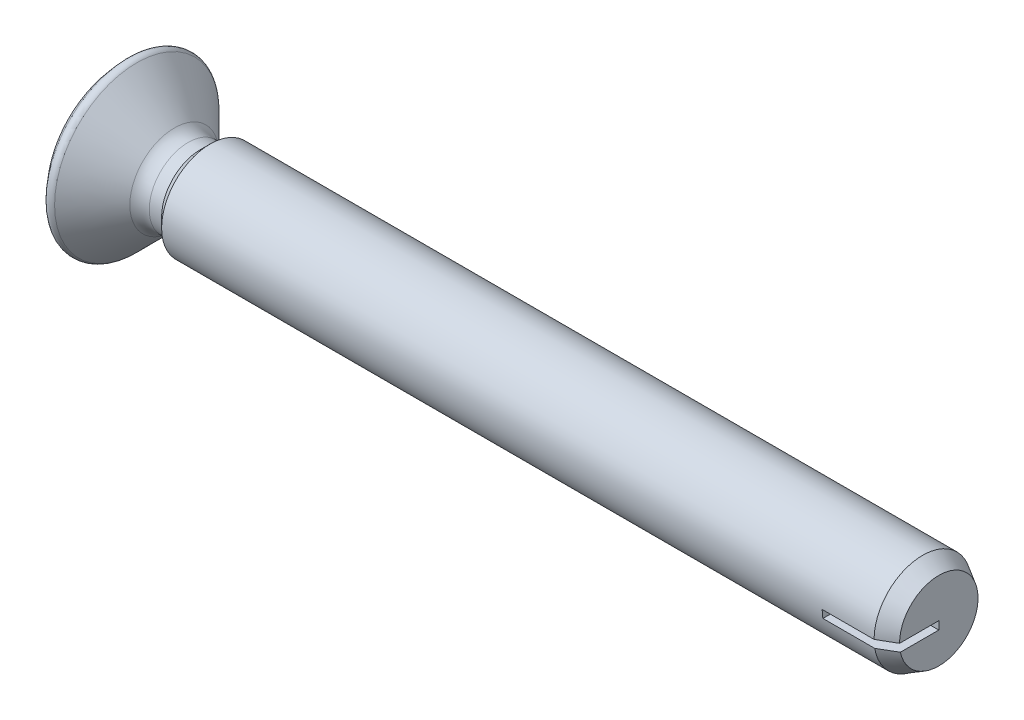
from build123d import *

# Parameters (mm, degrees)
CUT_EXTRUDE3_DEPTH         = 2.5
DRAFT1_ANGLE               = -20
RECESSI_CUT_EXTRUDE5_DEPTH = 2.5
SKETCH11_W                 = 7
SKETCH11_H                 = 0.833333333
POINT_CUT_EXTRUDE8_DEPTH   = 84.894801943


with BuildPart() as part:
    # Sketch1 → base-Revolve (revolve)
    with BuildSketch(Plane.XY, mode=Mode.PRIVATE) as base_revolve_sk:
        with BuildLine():
            Line((0.441941738, 8.458058262), (4.314213562, 4.585786438))
            ThreePointArc((4.314213562, 4.585786438), (4.96306026, 4.152240935), (5.728427125, 4))
            Line((5.728427125, 4), (7, 4))
            Line((7, 4), (8, 5))
            Line((8, 5), (83, 5))
            Line((83, 5), (83, 0))
            Line((83, 0), (0, 0))
            Line((0, 0), (-3.821717386, 0))
            ThreePointArc((-3.821717386, 0), (-2.948605496, 4.546518178), (-0.453487574, 8.446202584))
            ThreePointArc((-0.453487574, 8.446202584), (-0.00827441, 8.641061748), (0.441941738, 8.458058262))
        make_face()
    revolve(base_revolve_sk.sketch.rotate(Axis((0, 0, 0), (1, 0, 0)), 90), axis=Axis((0, 0, 0), (1, 0, 0)))

    # Sketch4 → Cut-Extrude3 (cut)
    with BuildSketch(Plane(origin=(-3.821717386, 0, 0), x_dir=(0, 0, -1), z_dir=(1, 0, 0))):
        Polygon((0.99, 4.94), (-0.99, 4.94), (-0.99, 0.99), (-4.94, 0.99), (-4.94, -0.99), (-0.99, -0.99), (-0.99, -4.94), (0.99, -4.94), (0.99, -0.99), (4.94, -0.99), (4.94, 0.99), (0.99, 0.99), align=None)
    extrude(amount=CUT_EXTRUDE3_DEPTH, mode=Mode.SUBTRACT)

    # Draft1
    draft1_faces = [part.faces().sort_by_distance(p)[0] for p in [
        (-2.045493587, 0, -4.94),
        (-2.045493587, -4.94, 0),
        (-2.045493587, 0, 4.94),
        (-2.045493587, 4.94, 0),
    ]]
    draft(draft1_faces, Plane(origin=(-3.821717386, 0, 0), x_dir=(0, 0, 1), z_dir=(1, 0, 0)), DRAFT1_ANGLE)

    # Sketch5 → recessI_Cut-Extrude5 (cut)
    with BuildSketch(Plane.ZY.offset(3.821717386)):
        Polygon((0.99, 1.978), (1.978, 0.99), (0.99, 0.99), align=None)
        Polygon((-0.99, 0.99), (-1.978, 0.99), (-0.99, 1.978), align=None)
        Polygon((-0.99, -1.978), (-1.978, -0.99), (-0.99, -0.99), align=None)
        Polygon((0.99, -0.99), (1.978, -0.99), (0.99, -1.978), align=None)
    extrude(amount=-RECESSI_CUT_EXTRUDE5_DEPTH, mode=Mode.SUBTRACT)

    # Sketch8 → point_Cut-Revolve1 (revolve, cut)
    with BuildSketch(Plane.XY, mode=Mode.PRIVATE) as point_cut_revolve1_sk:
        Polygon((83, 0), (83.508, 0), (83.508, 5.508), (81.337231225, 5.508), (81.337231225, 5), (83, 4.04), align=None)
    revolve(point_cut_revolve1_sk.sketch.rotate(Axis((0, 0, 0), (1, 0, 0)), 90), axis=Axis((0, 0, 0), (1, 0, 0)), mode=Mode.SUBTRACT)

    # Sketch11 → point_Cut-Extrude8 (cut, through all)
    with BuildSketch(Plane.XY):
        with Locations((79.5, -0.416666667)):
            Rectangle(SKETCH11_W, SKETCH11_H)
    extrude(amount=POINT_CUT_EXTRUDE8_DEPTH, mode=Mode.SUBTRACT)


solid = part.part
